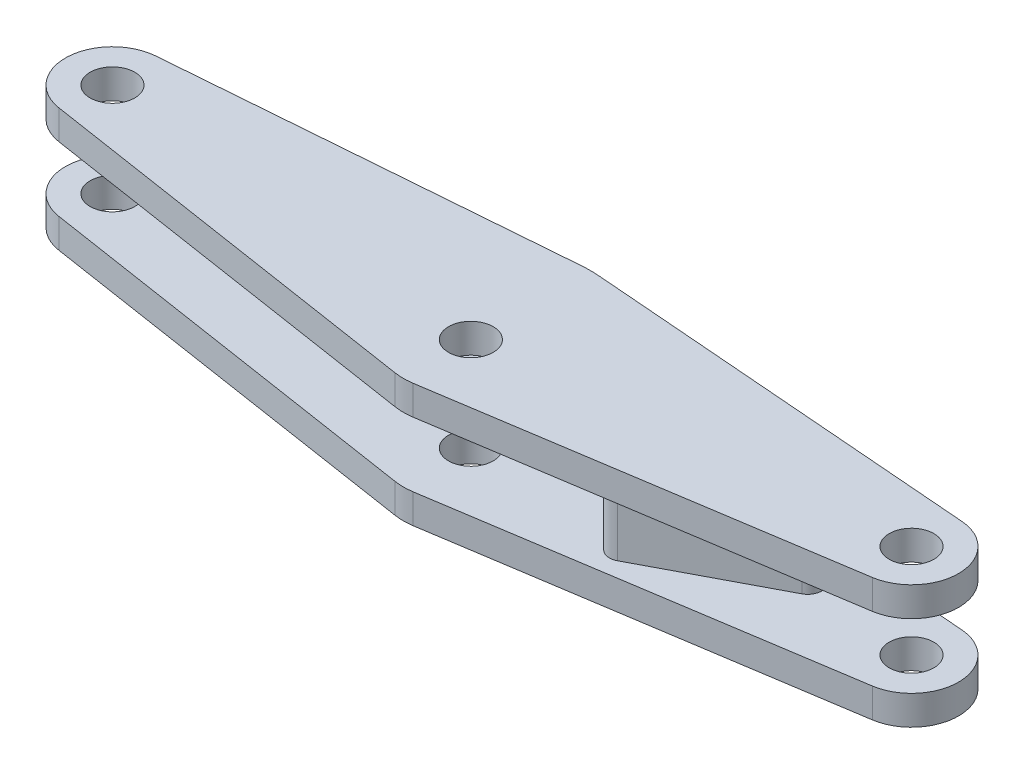
from build123d import *

# Parameters (mm, degrees)
SKETCH1_R                = 0.95
BOSS_EXTRUDE1_DEPTH      = 2.625
CUT_EXTRUDE1_DEPTH       = 20.729120518
CUT_EXTRUDE1_DEPTH_BACK  = 5.25
SKETCH2_W                = 38
SKETCH2_H                = 2.75
BOSS_EXTRUDE2_DEPTH      = 2.625
BOSS_EXTRUDE2_DEPTH_BACK = 1.375


with BuildPart() as part:
    # Sketch1 → Boss-Extrude1 (new, symmetric)
    with BuildSketch(Plane(origin=(0, 0, 0), x_dir=(1, 0, 0), z_dir=(0, 1, 0))):
        with BuildLine():
            Line((-0.393995074, 3.318856737), (-17.15759803, 1.993781046))
            ThreePointArc((-17.15759803, 1.993781046), (-18.998616533, 0.074377097), (-17.305351185, -1.97655272))
            Line((-17.305351185, -1.97655272), (-0.381688981, -4.591034114))
            ThreePointArc((-0.381688981, -4.591034114), (0, -4.620343214), (0.381688981, -4.591034114))
            Line((0.381688981, -4.591034114), (17.305351185, -1.97655272))
            ThreePointArc((17.305351185, -1.97655272), (18.998616533, 0.074377097), (17.15759803, 1.993781046))
            Line((17.15759803, 1.993781046), (0.393995074, 3.318856737))
            ThreePointArc((0.393995074, 3.318856737), (0, 3.334404121), (-0.393995074, 3.318856737))
        make_face()
        with Locations(Location((-17, 0, 0), (0, 0, 90))):
            Circle(SKETCH1_R, mode=Mode.SUBTRACT)
        with Locations(Location((17, 0, 0), (0, 0, 90))):
            Circle(SKETCH1_R, mode=Mode.SUBTRACT)
        with Locations(Location((0, -1.75, 0), (0, 0, 90))):
            Circle(SKETCH1_R, mode=Mode.SUBTRACT)
    extrude(amount=BOSS_EXTRUDE1_DEPTH, both=True)

    # Sketch2 → Cut-Extrude1 (cut, two sides: drawn at the far end of the back side and taken through both)
    with BuildSketch(Plane.XY.offset(-CUT_EXTRUDE1_DEPTH_BACK)):
        Rectangle(SKETCH2_W, SKETCH2_H)
    extrude(amount=CUT_EXTRUDE1_DEPTH + CUT_EXTRUDE1_DEPTH_BACK, mode=Mode.SUBTRACT)


with BuildPart() as cut_extrude1_piece_1:
    # of the separate pieces the step leaves, piece 1, a body of its own (cut_extrude1_pieces)
    add(part.part.solids().sort_by_distance((17.15759803, 2.625, -1.993781046))[0])



with BuildPart() as cut_extrude1_piece_2:
    # of the separate pieces the step leaves, piece 2, a body of its own (cut_extrude1_pieces)
    add(part.part.solids().sort_by_distance((17.15759803, -1.375, -1.993781046))[0])


with BuildPart() as cut_extrude1_piece_1_1:
    add(cut_extrude1_piece_1.part)

    add(cut_extrude1_piece_2.part)  # Boss-Extrude2 merges Cut-Extrude1 piece 2
    # Sketch3 → Boss-Extrude2 (add, two sides: drawn at the far end of the back side and taken through both)
    with BuildSketch(Plane(origin=(0, 0, 0), x_dir=(1, 0, 0), z_dir=(0, 1, 0)).offset(-BOSS_EXTRUDE2_DEPTH_BACK)):
        with BuildLine():
            Line((12.412535452, -0.081023287), (7.279310345, -2.781023287))
            ThreePointArc((7.279310345, -2.781023287), (6.468976713, -2.529310345), (6.720689655, -1.718976713))
            Line((6.720689655, -1.718976713), (11.853914762, 0.981023287))
            ThreePointArc((11.853914762, 0.981023287), (12.664248394, 0.729310345), (12.412535452, -0.081023287))
        make_face()
    extrude(amount=BOSS_EXTRUDE2_DEPTH + BOSS_EXTRUDE2_DEPTH_BACK)


solid = cut_extrude1_piece_1_1.part
